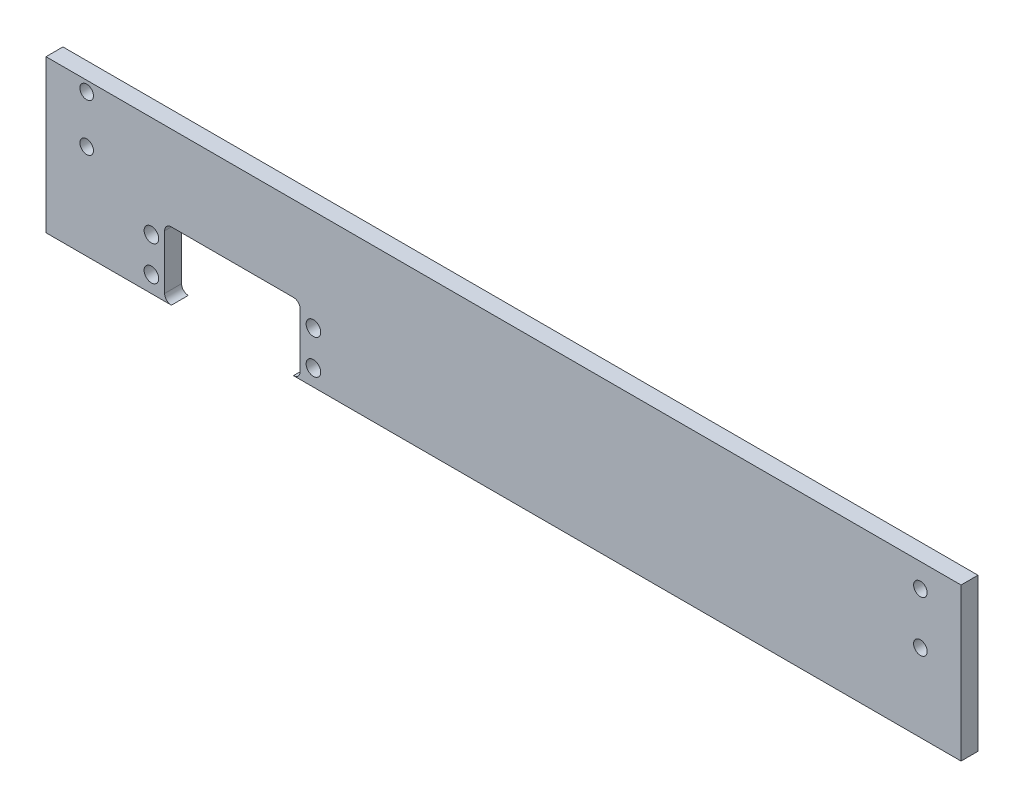
from build123d import *

# Parameters (mm, degrees)
ESQUISSE1_W                  = 270
ESQUISSE1_H                  = 75
BOSS_EXTRU_1_DEPTH           = 5
ESQUISSE2_R                  = 2
ENL_V_MAT_EXTRU_1_DEPTH      = 141.200748928
ENL_V_MAT_EXTRU_2_DEPTH      = 141.200748928
ENL_V_MAT_EXTRU_2_DEPTH_BACK = 141.200748928
ESQUISSE4_W                  = 270
ESQUISSE4_H                  = 5
ENL_V_MAT_EXTRU_3_DEPTH      = 30


with BuildPart() as part:
    # Esquisse1 → Boss.-Extru.1 (new body)
    with BuildSketch(Plane.XY):
        Rectangle(ESQUISSE1_W, ESQUISSE1_H)
    extrude(amount=BOSS_EXTRU_1_DEPTH)

    # Esquisse2 → Enlèv. mat.-Extru.1 (cut, through all)
    with BuildSketch(Plane.XY.offset(5)):
        with Locations((123, 0.5)):
            Circle(ESQUISSE2_R)
        with Locations((123, -14.5)):
            Circle(ESQUISSE2_R)
        with Locations((-123, 4.5)):
            Circle(ESQUISSE2_R)
        with Locations((-123, -9.5)):
            Circle(ESQUISSE2_R)
    extrude(amount=-ENL_V_MAT_EXTRU_1_DEPTH, mode=Mode.SUBTRACT)

    # Esquisse3 → Enlèv. mat.-Extru.2 (cut, two sides: drawn at the far end of the back side and taken through both)
    with BuildSketch(Plane.XY.offset(5).offset(-ENL_V_MAT_EXTRU_2_DEPTH_BACK)):
        with BuildLine():
            Line((-98, -37.5), (-62, -37.5))
            ThreePointArc((-62, -37.5), (-60.585786438, -36.914213562), (-60, -35.5))
            Line((-60, -35.5), (-60, -19.5))
            ThreePointArc((-60, -19.5), (-60.585786438, -18.085786438), (-62, -17.5))
            Line((-62, -17.5), (-98, -17.5))
            ThreePointArc((-98, -17.5), (-99.414213562, -18.085786438), (-100, -19.5))
            Line((-100, -19.5), (-100, -35.5))
            ThreePointArc((-100, -35.5), (-99.414213562, -36.914213562), (-98, -37.5))
        make_face()
        with BuildLine():
            ThreePointArc((-54.387545621, -31.3), (-58.25, -32.6), (-54.387545621, -33.9))
            ThreePointArc((-54.387545621, -33.9), (-53.95, -32.6), (-54.387545621, -31.3))
        make_face()
        with BuildLine():
            ThreePointArc((-54.387545621, -21.1), (-58.25, -22.4), (-54.387545621, -23.7))
            ThreePointArc((-54.387545621, -23.7), (-53.95, -22.4), (-54.387545621, -21.1))
        make_face()
        with BuildLine():
            ThreePointArc((-105.612454379, -33.9), (-101.75, -32.6), (-105.612454379, -31.3))
            ThreePointArc((-105.612454379, -31.3), (-106.05, -32.6), (-105.612454379, -33.9))
        make_face()
        with BuildLine():
            ThreePointArc((-105.612454379, -23.7), (-101.75, -22.4), (-105.612454379, -21.1))
            ThreePointArc((-105.612454379, -21.1), (-106.05, -22.4), (-105.612454379, -23.7))
        make_face()
    extrude(amount=ENL_V_MAT_EXTRU_2_DEPTH + ENL_V_MAT_EXTRU_2_DEPTH_BACK, mode=Mode.SUBTRACT)

    # Esquisse4 → Enlèv. mat.-Extru.3 (cut)
    with BuildSketch(Plane(origin=(0, 37.5, 0), x_dir=(1, 0, 0), z_dir=(0, 1, 0))):
        with Locations((0, -2.5)):
            Rectangle(ESQUISSE4_W, ESQUISSE4_H)
    extrude(amount=-ENL_V_MAT_EXTRU_3_DEPTH, mode=Mode.SUBTRACT)


solid = part.part
